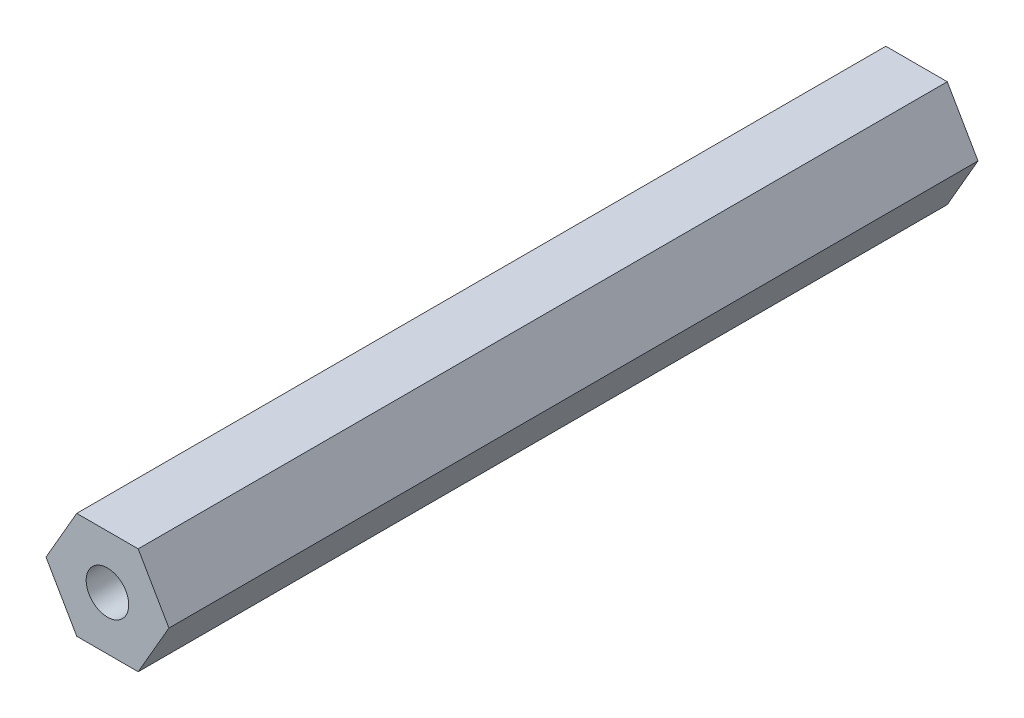
from build123d import *

# Parameters (mm, degrees)
BOSS_EXTRUDE1_DEPTH = 38
SKETCH2_R           = 1
CUT_EXTRUDE1_DEPTH  = 39.191403919


with BuildPart() as part:
    # Sketch1 → Boss-Extrude1 (new body)
    with BuildSketch(Plane.XY):
        Polygon((2.886751346, 0), (1.443375673, 2.5), (-1.443375673, 2.5), (-2.886751346, 0), (-1.443375673, -2.5), (1.443375673, -2.5), align=None)
    extrude(amount=BOSS_EXTRUDE1_DEPTH)

    # Sketch2 → Cut-Extrude1 (cut, through all)
    with BuildSketch(Plane.XY.offset(38)):
        Circle(SKETCH2_R)
    extrude(amount=-CUT_EXTRUDE1_DEPTH, mode=Mode.SUBTRACT)


solid = part.part
